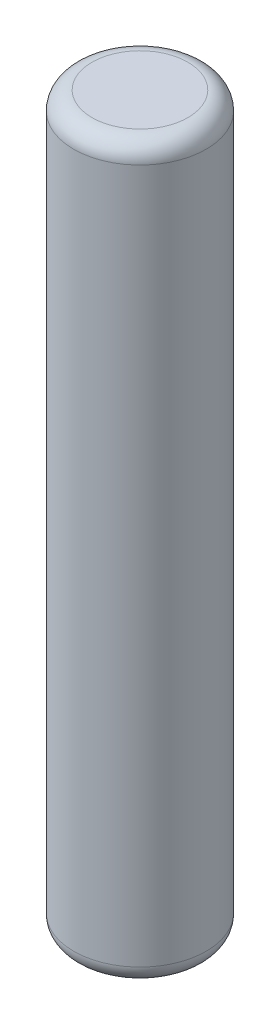
from build123d import *

# Parameters (mm, degrees)
ESQUISSE1_R        = 3.625
BOSS_EXTRU_1_DEPTH = 40
CONG_1_R           = 1
CONG_2_R           = 1


with BuildPart() as part:
    # Esquisse1 → Boss.-Extru.1 (new body)
    with BuildSketch(Plane(origin=(0, 0, 0), x_dir=(1, 0, 0), z_dir=(0, 1, 0))):
        with Locations(Location((0, 0, 0), (0, 0, 270))):
            Circle(ESQUISSE1_R)
    extrude(amount=BOSS_EXTRU_1_DEPTH)

    # Congé1
    cong_1_edges = [part.edges().sort_by_distance(p)[0] for p in [
        (0, 40, -3.625),
    ]]
    fillet(cong_1_edges, radius=CONG_1_R)

    # Congé2
    cong_2_edges = [part.edges().sort_by_distance(p)[0] for p in [
        (0, 0, -3.625),
    ]]
    fillet(cong_2_edges, radius=CONG_2_R)


solid = part.part
